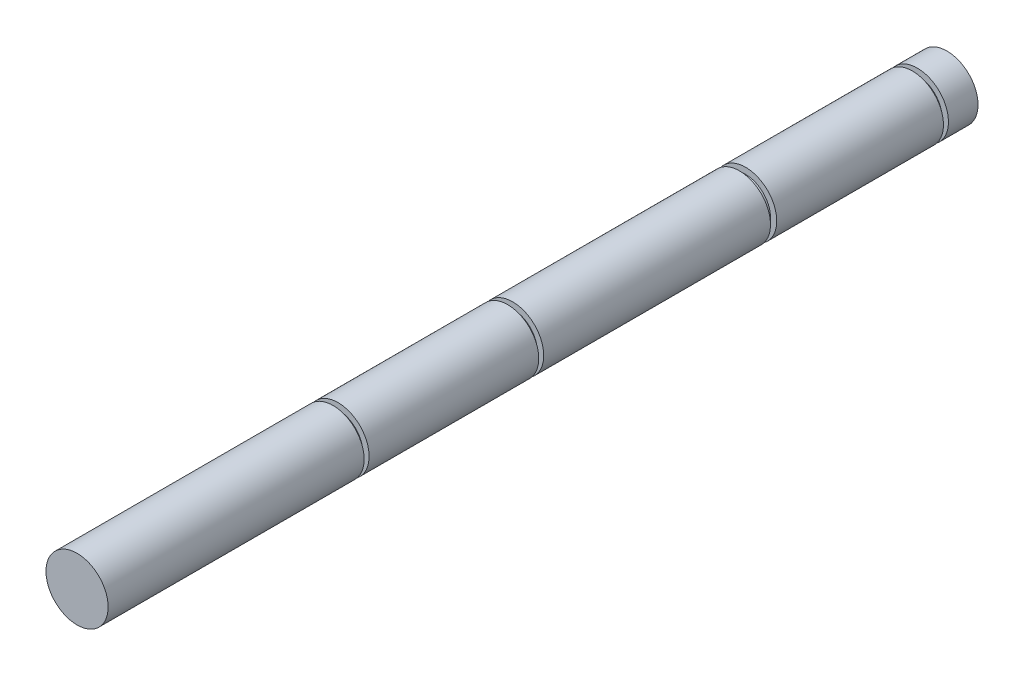
from build123d import *

# Parameters (mm, degrees)
SKETCH1_R           = 5
BOSS_EXTRUDE1_DEPTH = 135
SKETCH2_W           = 1
SKETCH2_H           = 0.8
BOSS_EXTRUDE2_START = 5
SKETCH3_R           = 5
BOSS_EXTRUDE2_DEPTH = 5
SKETCH4_R           = 5
SKETCH4_R_2         = 4
CUT_EXTRUDE1_DEPTH  = 0.8
SKETCH5_R           = 5
SKETCH5_R_2         = 4
CUT_EXTRUDE2_DEPTH  = 1


with BuildPart() as part:
    # Sketch1 → Boss-Extrude1 (new body)
    with BuildSketch(Plane.XY):
        Circle(SKETCH1_R)
    extrude(amount=BOSS_EXTRUDE1_DEPTH)

    # Sketch2 → Cut-Revolve1 (revolve, cut)
    with BuildSketch(Plane(origin=(0, 0, 0), x_dir=(1, 0, 0), z_dir=(0, 1, 0))):
        with Locations((-4.5, -65.3)):
            Rectangle(SKETCH2_W, SKETCH2_H)
        with Locations((-4.5, -93.4)):
            Rectangle(SKETCH2_W, SKETCH2_H)
    revolve(axis=Axis((0, 0, 6.050553304), (0, 0, 1)), mode=Mode.SUBTRACT)

    # Sketch3 → Boss-Extrude2 (add)
    with BuildSketch(Plane(origin=(0, 0, 0), x_dir=(-1, 0, 0), z_dir=(0, 0, -1)).offset(BOSS_EXTRUDE2_START)):
        Circle(SKETCH3_R)
    extrude(amount=-BOSS_EXTRUDE2_DEPTH)

    # Sketch4 → Cut-Extrude1 (cut)
    with BuildSketch(Plane(origin=(-672.545878218, -100.484437541, -0.235), x_dir=(-0.3247374432468007, 0.945804204343336, 0), z_dir=(0, 0, -1))):
        with Locations(Location((-123.362225461, 668.727778566, 0), (0, 0, 288.949668831))):
            Circle(SKETCH4_R)
        with Locations(Location((-123.362225461, 668.727778566, 0), (0, 0, 288.949668831))):
            Circle(SKETCH4_R_2, mode=Mode.SUBTRACT)
    extrude(amount=-CUT_EXTRUDE1_DEPTH, mode=Mode.SUBTRACT)

    # Sketch5 → Cut-Extrude2 (cut)
    with BuildSketch(Plane(origin=(-672.545878218, -100.484437541, 27.4), x_dir=(-0.3247374432468007, 0.945804204343336, 0), z_dir=(0, 0, -1))):
        with Locations(Location((-123.362225461, 668.727778566, 0), (0, 0, 288.949668831))):
            Circle(SKETCH5_R)
        with Locations(Location((-123.362225461, 668.727778566, 0), (0, 0, 288.949668831))):
            Circle(SKETCH5_R_2, mode=Mode.SUBTRACT)
    extrude(amount=-CUT_EXTRUDE2_DEPTH, mode=Mode.SUBTRACT)


solid = part.part
